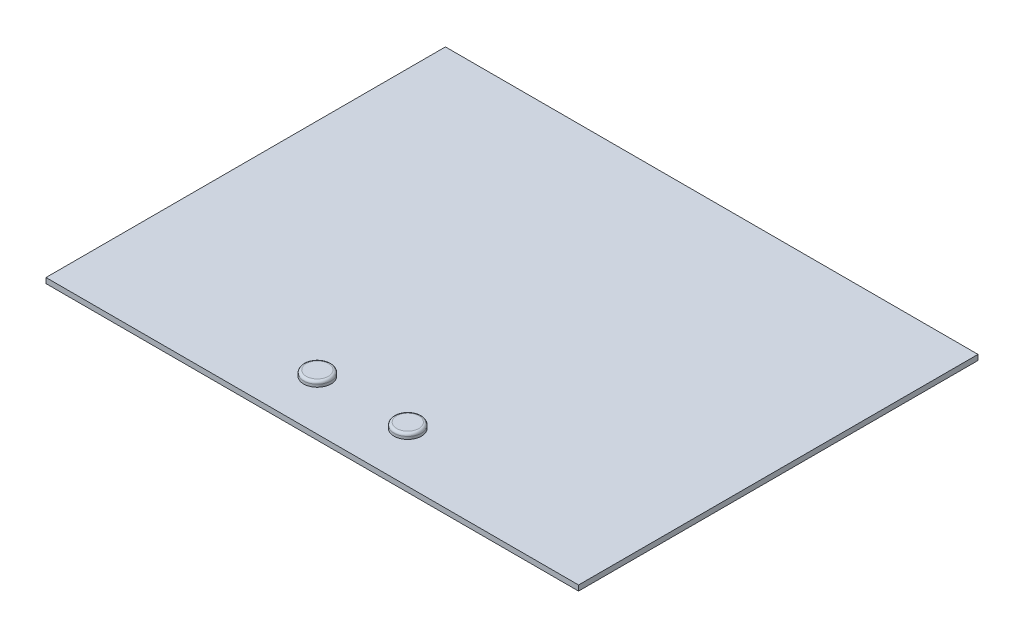
from build123d import *

# Parameters (mm, degrees)
SKETCH1_W           = 40
SKETCH1_H           = 30
BOSS_EXTRUDE1_DEPTH = 0.4
SKETCH2_R           = 1.030298152
BOSS_EXTRUDE2_DEPTH = 0.4
FILLET1_R           = 0.2


with BuildPart() as part:
    # Sketch1 → Boss-Extrude1 (new body)
    with BuildSketch(Plane(origin=(0, 0, 0), x_dir=(1, 0, 0), z_dir=(0, 1, 0))):
        with Locations((20, 15)):
            Rectangle(SKETCH1_W, SKETCH1_H)
    extrude(amount=BOSS_EXTRUDE1_DEPTH)

    # Sketch2 → Boss-Extrude2 (add)
    with BuildSketch(Plane(origin=(0, 0.4, 0), x_dir=(1, 0, 0), z_dir=(0, 1, 0))):
        with Locations(Location((16.603964513, 3.777163976, 0), (0, 0, 90))):
            Circle(SKETCH2_R)
        with Locations(Location((23.396035487, 3.777163976, 0), (0, 0, 90))):
            Circle(SKETCH2_R)
    extrude(amount=BOSS_EXTRUDE2_DEPTH)

    # Fillet1
    fillet1_edges = [part.edges().sort_by_distance(p)[0] for p in [
        (16.603964513, 0.8, -2.746865824),
        (23.396035487, 0.8, -2.746865824),
    ]]
    fillet(fillet1_edges, radius=FILLET1_R)


solid = part.part
